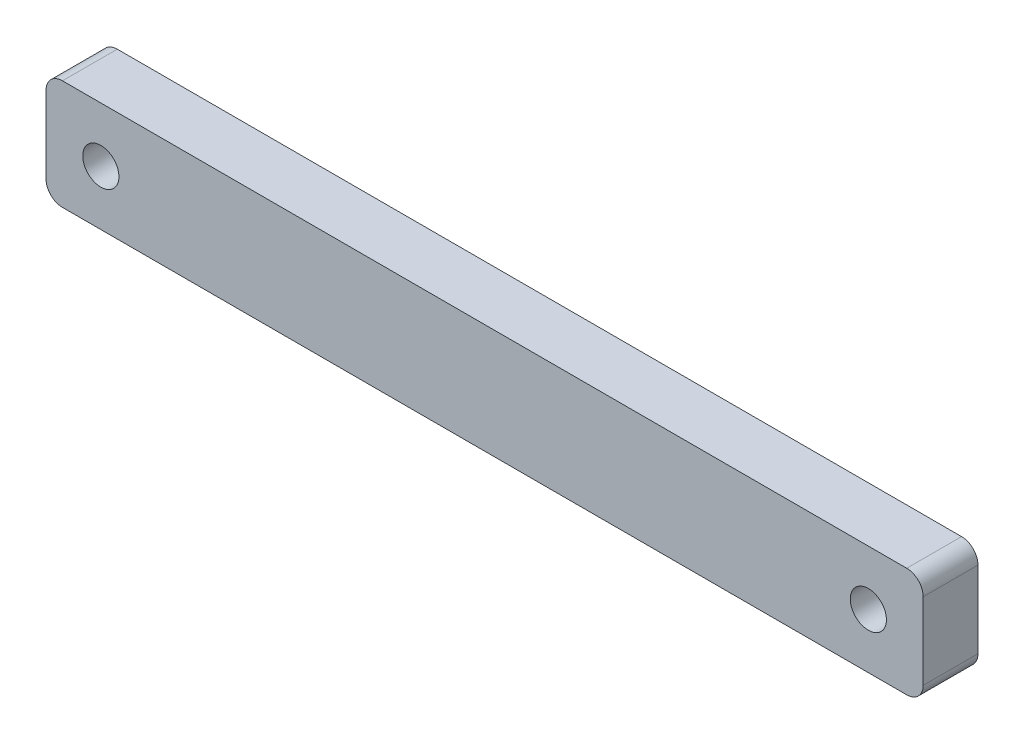
from build123d import *

# Parameters (mm, degrees)
SKETCH1_R             = 4.191
BOSS_EXTRUDE1_DEPTH   = 12.7
SKETCH2_R             = 3.683
BOSS_EXTRUDE2_DEPTH   = 6.35
BOSS_EXTRUDE2_2_DEPTH = 6.35


with BuildPart() as part:
    # Sketch1 → Boss-Extrude1 (new body)
    with BuildSketch(Plane.XY):
        with BuildLine():
            Line((97.79, -12.7), (-97.79, -12.7))
            ThreePointArc((-97.79, -12.7), (-100.484076836, -11.584076836), (-101.6, -8.89))
            Line((-101.6, -8.89), (-101.6, 8.89))
            ThreePointArc((-101.6, 8.89), (-100.484076836, 11.584076836), (-97.79, 12.7))
            Line((-97.79, 12.7), (97.79, 12.7))
            ThreePointArc((97.79, 12.7), (100.484076836, 11.584076836), (101.6, 8.89))
            Line((101.6, 8.89), (101.6, -8.89))
            ThreePointArc((101.6, -8.89), (100.484076836, -11.584076836), (97.79, -12.7))
        make_face()
        with Locations((-88.9, 0)):
            Circle(SKETCH1_R, mode=Mode.SUBTRACT)
        with Locations((88.9, 0)):
            Circle(SKETCH1_R, mode=Mode.SUBTRACT)
    extrude(amount=BOSS_EXTRUDE1_DEPTH)


with BuildPart() as body_2:
    # Sketch2 → Boss-Extrude2 (new body)
    with BuildSketch(Plane(origin=(0, 0, 0), x_dir=(-1, 0, 0), z_dir=(0, 0, -1))):
        with Locations((-88.9, 0)):
            Circle(SKETCH2_R)
    extrude(amount=-BOSS_EXTRUDE2_DEPTH)


with BuildPart() as body_3:
    # Sketch2 → Boss-Extrude2 2 (new body)
    with BuildSketch(Plane(origin=(0, 0, 0), x_dir=(-1, 0, 0), z_dir=(0, 0, -1))):
        with Locations((88.9, 0)):
            Circle(SKETCH2_R)
    extrude(amount=-BOSS_EXTRUDE2_2_DEPTH)


solid = Compound([part.part, body_2.part, body_3.part])
